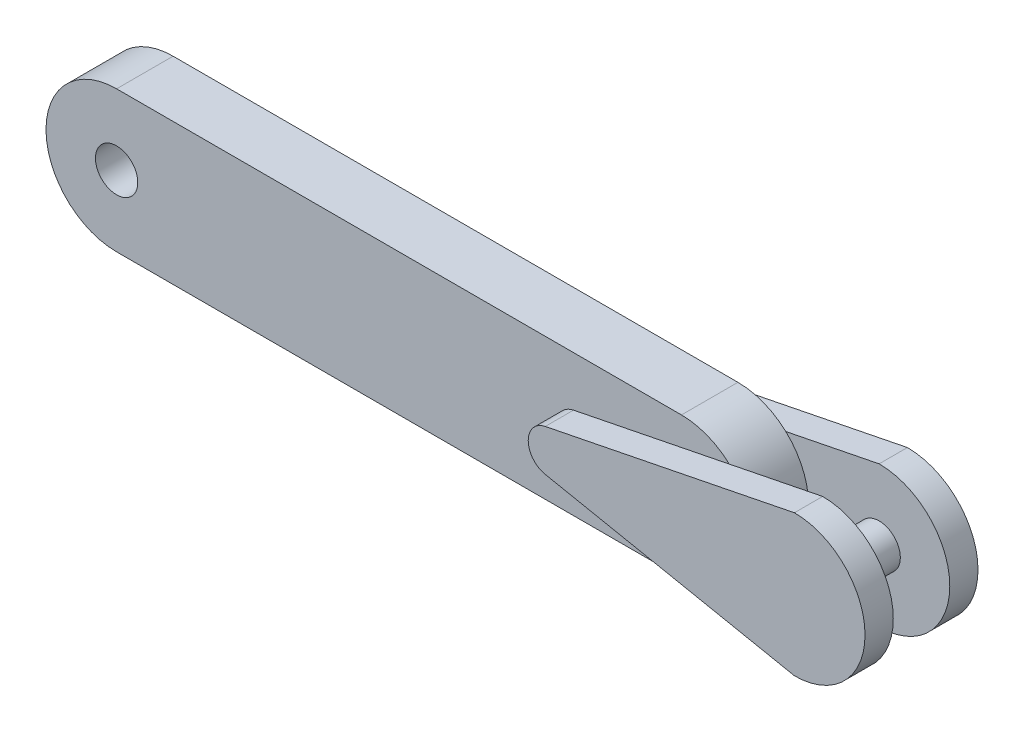
from build123d import *

# Parameters (mm, degrees)
BOSS_EXTRUDE2_DEPTH = 40
CUT_EXTRUDE6_DEPTH  = 20
SKETCH11_R          = 15
BOSS_EXTRUDE3_DEPTH = 80
CUT_EXTRUDE7_DEPTH  = 20
CUT_EXTRUDE9_START  = -20
CUT_EXTRUDE9_DEPTH  = 20
SKETCH15_R          = 15
CUT_EXTRUDE10_DEPTH = 40


with BuildPart() as part:
    # Sketch4 → Boss-Extrude2 (new, symmetric)
    with BuildSketch(Plane.XY):
        with BuildLine():
            Line((-250, 50), (250, 50))
            ThreePointArc((250, 50), (300, 0), (250, -50))
            Line((250, -50), (-250, -50))
            ThreePointArc((-250, -50), (-300, 0), (-250, 50))
        make_face()
    extrude(amount=BOSS_EXTRUDE2_DEPTH, both=True)

    # Sketch10 → Cut-Extrude6 (cut, symmetric)
    with BuildSketch(Plane.XY):
        with BuildLine():
            Line((150, 50), (250, 50))
            ThreePointArc((250, 50), (300, 0), (250, -50))
            Line((250, -50), (150, -50))
            ThreePointArc((150, -50), (200, 0), (150, 50))
        make_face()
    extrude(amount=CUT_EXTRUDE6_DEPTH, both=True, mode=Mode.SUBTRACT)

    # Sketch11 → Boss-Extrude3 (add)
    with BuildSketch(Plane.XY.offset(40)):
        with Locations((250, 0)):
            Circle(SKETCH11_R)
    extrude(amount=-BOSS_EXTRUDE3_DEPTH)

    # Sketch12 → Cut-Extrude7 (cut)
    with BuildSketch(Plane.XY.offset(40)):
        with BuildLine():
            Line((250, 50), (73.543550677, 14.708710135))
            ThreePointArc((73.543550677, 14.708710135), (61.485292704, 0), (73.543550677, -14.708710135))
            Line((73.543550677, -14.708710135), (250, -50))
            Line((250, -50), (-250, -50))
            ThreePointArc((-250, -50), (-300, 0), (-250, 50))
            Line((-250, 50), (250, 50))
        make_face()
    extrude(amount=-CUT_EXTRUDE7_DEPTH, mode=Mode.SUBTRACT)

    # Sketch14 → Cut-Extrude9 (cut)
    with BuildSketch(Plane(origin=(0, 0, -40), x_dir=(-1, 0, 0), z_dir=(0, 0, -1)).offset(CUT_EXTRUDE9_START)):
        with BuildLine():
            Line((-73.543550677, -14.708710135), (-250, -50))
            Line((-250, -50), (250, -50))
            ThreePointArc((250, -50), (300, 0), (250, 50))
            Line((250, 50), (-250, 50))
            Line((-250, 50), (-73.543550677, 14.708710135))
            ThreePointArc((-73.543550677, 14.708710135), (-61.485292704, 0), (-73.543550677, -14.708710135))
        make_face()
    extrude(amount=CUT_EXTRUDE9_DEPTH, mode=Mode.SUBTRACT)

    # Sketch15 → Cut-Extrude10 (cut)
    with BuildSketch(Plane(origin=(0, 0, -20), x_dir=(-1, 0, 0), z_dir=(0, 0, -1))):
        with Locations((250, 0)):
            Circle(SKETCH15_R)
    extrude(amount=-CUT_EXTRUDE10_DEPTH, mode=Mode.SUBTRACT)


with BuildPart() as part_1:
    # Body-Move/Copy1: moved
    add(part.part.moved(Location((250, 0, 0))))


solid = part_1.part
